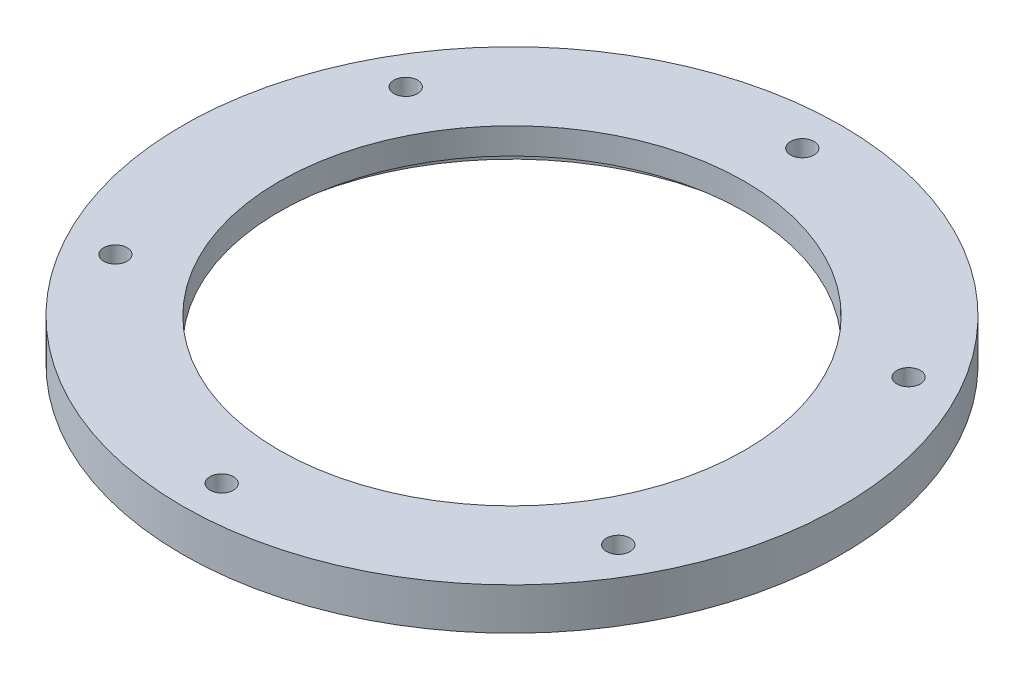
from build123d import *

# Parameters (mm, degrees)
CROQUIS1_R              = 63
CROQUIS1_R_2            = 44.5
CROQUIS1_R_3            = 2.25
SALIENTE_EXTRUIR1_DEPTH = 8
CROQUIS2_R              = 48
CORTAR_EXTRUIR1_DEPTH   = 3


with BuildPart() as part:
    # Croquis1 → Saliente-Extruir1 (new body)
    with BuildSketch(Plane(origin=(0, 0, 0), x_dir=(1, 0, 0), z_dir=(0, 1, 0))):
        with Locations(Location((0, 0, 0), (0, 0, 270))):
            Circle(CROQUIS1_R)
        with Locations(Location((0, 0, 0), (0, 0, 270))):
            Circle(CROQUIS1_R_2, mode=Mode.SUBTRACT)
        with Locations(Location((0, 55.5, 0), (0, 0, 270))):
            Circle(CROQUIS1_R_3, mode=Mode.SUBTRACT)
        with Locations(Location((48.06440991, 27.75, 0), (0, 0, 270))):
            Circle(CROQUIS1_R_3, mode=Mode.SUBTRACT)
        with Locations(Location((48.06440991, -27.75, 0), (0, 0, 270))):
            Circle(CROQUIS1_R_3, mode=Mode.SUBTRACT)
        with Locations(Location((0, -55.5, 0), (0, 0, 270))):
            Circle(CROQUIS1_R_3, mode=Mode.SUBTRACT)
        with Locations(Location((-48.06440991, -27.75, 0), (0, 0, 270))):
            Circle(CROQUIS1_R_3, mode=Mode.SUBTRACT)
        with Locations(Location((-48.06440991, 27.75, 0), (0, 0, 270))):
            Circle(CROQUIS1_R_3, mode=Mode.SUBTRACT)
    extrude(amount=SALIENTE_EXTRUIR1_DEPTH)

    # Croquis2 → Cortar-Extruir1 (cut)
    with BuildSketch(Plane.XZ):
        with Locations(Location((0, 0, 0), (0, 0, 270))):
            Circle(CROQUIS2_R)
    extrude(amount=-CORTAR_EXTRUIR1_DEPTH, mode=Mode.SUBTRACT)


solid = part.part
